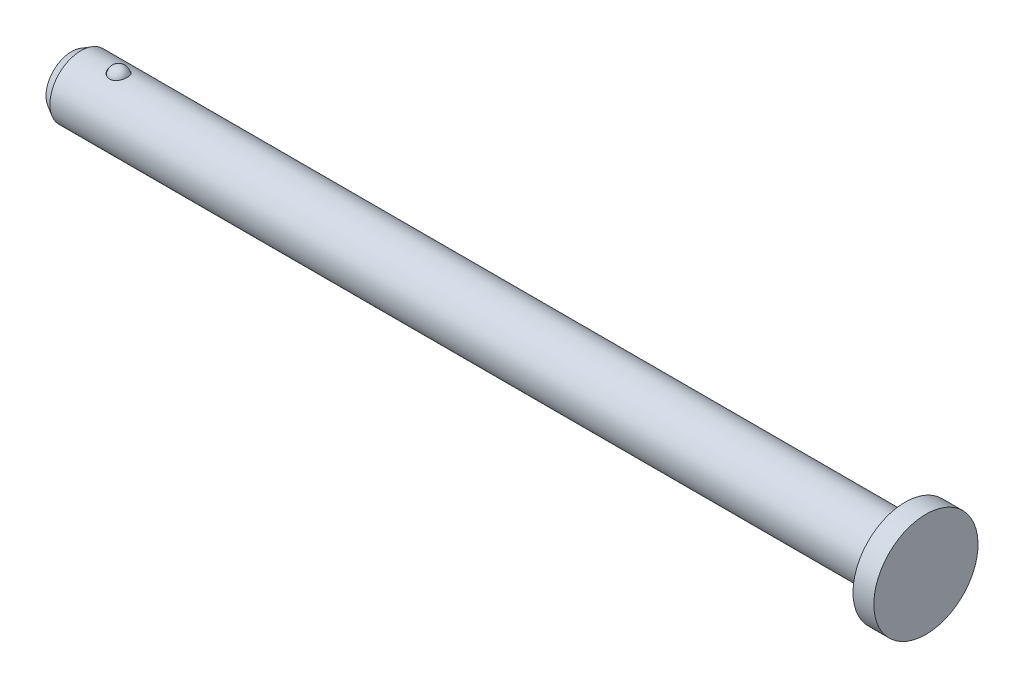
from build123d import *


with BuildPart() as part:
    # Sketch1 → Revolve1 (revolve)
    with BuildSketch(Plane.XY, mode=Mode.PRIVATE) as revolve1_sk:
        Polygon((32.54375, 3.96875), (30.95625, 3.96875), (30.95625, 2.3622), (-31.83509, 2.3622), (-32.54375, 1.953054958), (-32.54375, 0), (32.54375, 0), align=None)
    revolve(revolve1_sk.sketch.rotate(Axis((-32.54375, 0, 0), (1, 0, 0)), 180), axis=Axis((-32.54375, 0, 0), (1, 0, 0)))

    # Sketch2 → Cut-Revolve1 (revolve, cut)
    with BuildSketch(Plane.XY):
        with BuildLine():
            Line((-28.26832515, 2.15077515), (-29.65637485, 2.15077515))
            ThreePointArc((-29.65637485, 2.15077515), (-28.96235, 2.8448), (-28.26832515, 2.15077515))
        make_face()
    revolve(axis=Axis((-28.26832515, 2.15077515, 0), (1, 0, 0)), mode=Mode.SUBTRACT)


with BuildPart() as body_2:
    # Sketch3 → Revolve2 (revolve)
    with BuildSketch(Plane.XY):
        with BuildLine():
            Line((-28.29372515, 2.15077515), (-29.63097485, 2.15077515))
            ThreePointArc((-29.63097485, 2.15077515), (-28.96235, 2.8194), (-28.29372515, 2.15077515))
        make_face()
    revolve(axis=Axis((-28.29372515, 2.15077515, 0), (1, 0, 0)))


solid = Compound([part.part, body_2.part])
